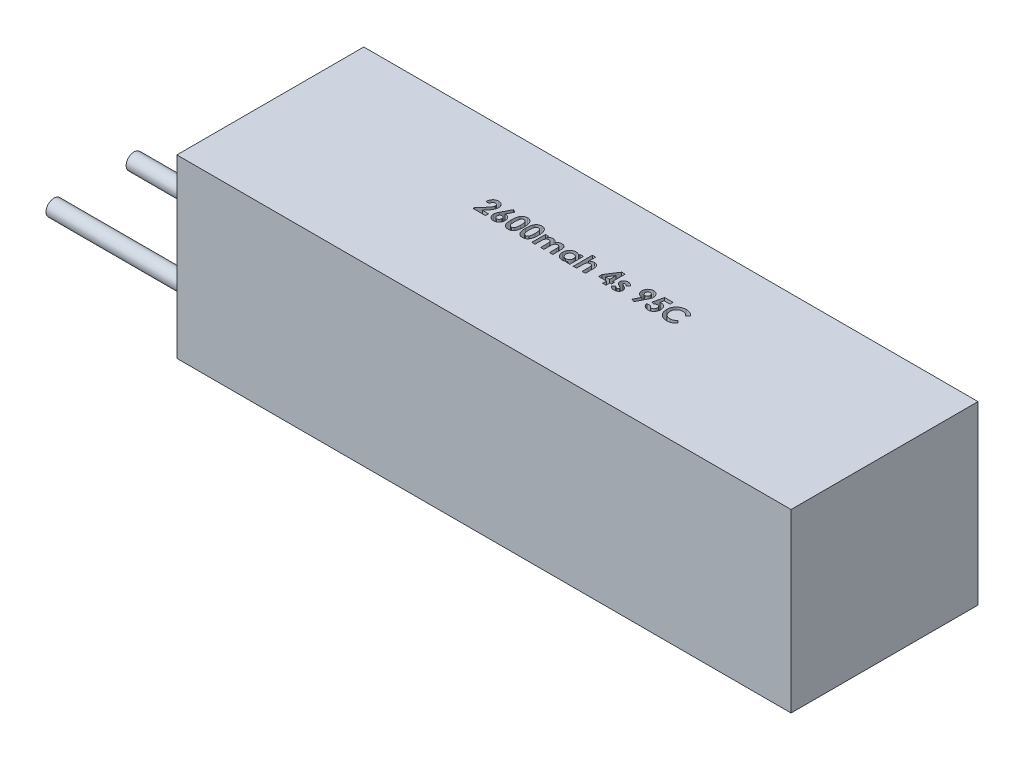
from build123d import *

# Parameters (mm, degrees)
SKETCH_1_W          = 115
SKETCH_1_H          = 35
EXTRUDE_1_DEPTH     = 33
SKETCH_2_R          = 1.5
EXTRUDE_2_DEPTH     = 33
CUT_EXTRUDE_1_DEPTH = 5


with BuildPart() as part:
    # 草图1 → 凸台-拉伸1 (new body)
    with BuildSketch(Plane(origin=(0, 0, 0), x_dir=(1, 0, 0), z_dir=(0, 1, 0))):
        Rectangle(SKETCH_1_W, SKETCH_1_H)
    extrude(amount=EXTRUDE_1_DEPTH)

    # 草图2 → 凸台-拉伸2 (add)
    with BuildSketch(Plane.ZY.offset(57.5)):
        with Locations(Location((-7.5, 3, 0), (0, 0, 180))):
            Circle(SKETCH_2_R)
        with Locations(Location((7.5, 3, 0), (0, 0, 180))):
            Circle(SKETCH_2_R)
    extrude(amount=EXTRUDE_2_DEPTH)

    # 草图3 → 切除-拉伸1 (cut)
    # profile 1 of 12: a face of its own
    with BuildSketch(Plane(origin=(0, 33, 0), x_dir=(1, 0, 0), z_dir=(0, 1, 0))):
        with BuildLine():
            Line((-20.376591675, 3.878020707), (-21.004796803, 3.878020707))
            add(Edge.make_bspline(
                [(-21.004796803, 3.878020707), (-21.002083681, 3.925541102), (-20.996782405, 4.018393099), (-20.975695266, 4.153263599), (-20.947439223, 4.28070139), (-20.909727784, 4.400260682), (-20.862340892, 4.51189803), (-20.806497936, 4.615994012), (-20.740772254, 4.71200056), (-20.666562705, 4.799454677), (-20.585129162, 4.877910573), (-20.498162268, 4.947474498), (-20.404331745, 5.004876899), (-20.305351953, 5.052113761), (-20.201239748, 5.089853818), (-20.091010064, 5.1150861), (-19.975617329, 5.132173649), (-19.896621658, 5.133668878), (-19.856359303, 5.134430963)],
                knots=[0, 0, 0, 0, 1.199038563, 2.342849363, 3.436047546, 4.486744587, 5.497670872, 6.488682221, 7.459191391, 8.424610317, 9.374430501, 10.305433194, 11.225809216, 12.140057399, 13.06607119, 14.010487599, 14.985989317, 16, 16, 16, 16], degree=3))
            add(Edge.make_bspline(
                [(-19.856359303, 5.134430963), (-19.806937833, 5.132888883), (-19.710455543, 5.129878382), (-19.570259122, 5.104197802), (-19.439330994, 5.061243064), (-19.31776633, 5.001223967), (-19.206600033, 4.924975997), (-19.105850536, 4.83406277), (-19.018564665, 4.726576881), (-18.944189003, 4.606990641), (-18.882391716, 4.480365644), (-18.839086751, 4.349430146), (-18.810622864, 4.217658644), (-18.807587015, 4.128930384), (-18.806078854, 4.084851637)],
                knots=[0, 0, 0, 0, 1.075374347, 2.099382735, 3.09057751, 4.06680945, 5.040638231, 6.016817125, 7.011024321, 8.044445721, 9.0776792, 10.070479129, 11.0414456, 12, 12, 12, 12], degree=3))
            add(Edge.make_bspline(
                [(-18.806078854, 4.084851637), (-18.806666052, 4.058189695), (-18.807847937, 4.004525791), (-18.816065738, 3.923319135), (-18.828394063, 3.84060066), (-18.846982172, 3.756441292), (-18.870163069, 3.670817439), (-18.898284847, 3.583472858), (-18.931999819, 3.49490276), (-18.97074535, 3.404110305), (-19.016968867, 3.310800725), (-19.070789728, 3.213575273), (-19.13363646, 3.112520195), (-19.204749953, 3.007064902), (-19.28447559, 2.897375714), (-19.373202564, 2.783783047), (-19.469908948, 2.665886638), (-19.53854419, 2.587079505), (-19.57380722, 2.546590419)],
                knots=[0, 0, 0, 0, 0.728284026, 1.46585585, 2.227944881, 3.01186502, 3.81876927, 4.650621989, 5.517437689, 6.406905708, 7.346299482, 8.360816762, 9.441613733, 10.596154504, 11.834900912, 13.145207542, 14.533280747, 16, 16, 16, 16], degree=3))
            Line((-19.57380722, 2.546590419), (-19.939091675, 2.128020707))
            Line((-19.939091675, 2.128020707), (-18.761207059, 2.128020707))
            Line((-18.761207059, 2.128020707), (-18.761207059, 1.544687374))
            Line((-18.761207059, 1.544687374), (-21.094540393, 1.544687374))
            Line((-21.094540393, 1.544687374), (-21.094540393, 1.862996669))
            Line((-21.094540393, 1.862996669), (-20.05828238, 2.965861252))
            add(Edge.make_bspline(
                [(-20.05828238, 2.965861252), (-20.028280047, 2.998032154), (-19.970174427, 3.060337652), (-19.887496117, 3.151839903), (-19.81267955, 3.238673356), (-19.747276108, 3.32176261), (-19.687853503, 3.39841259), (-19.637061383, 3.47093362), (-19.594435042, 3.538670085), (-19.548158103, 3.620348432), (-19.504210223, 3.717764395), (-19.463885384, 3.829991579), (-19.439304603, 3.937254921), (-19.435911678, 4.007150019), (-19.434283982, 4.040680963)],
                knots=[0, 0, 0, 0, 1.246127091, 2.413378631, 3.493388633, 4.492180848, 5.408488754, 6.240484944, 6.999099869, 7.674939598, 8.898438119, 10.020720584, 11.050475521, 12, 12, 12, 12], degree=3))
            add(Edge.make_bspline(
                [(-19.434283982, 4.040680963), (-19.435500971, 4.073119565), (-19.437859083, 4.135974556), (-19.463772816, 4.225385446), (-19.50391927, 4.30633788), (-19.560491295, 4.376412908), (-19.629017734, 4.433998204), (-19.708206472, 4.47682853), (-19.797411886, 4.501541432), (-19.859946582, 4.504634604), (-19.892116514, 4.506225835)],
                knots=[0, 0, 0, 0, 1.062038974, 2.057870785, 3.028805853, 4.01125022, 4.991535629, 5.949134679, 6.94496649, 8, 8, 8, 8], degree=3))
            add(Edge.make_bspline(
                [(-19.892116514, 4.506225835), (-19.908735911, 4.505638015), (-19.941453863, 4.504480798), (-19.989546695, 4.496777513), (-20.03531048, 4.483201277), (-20.079254594, 4.465011032), (-20.120910054, 4.440899731), (-20.160171792, 4.411178712), (-20.19745348, 4.376603253), (-20.232584129, 4.337281466), (-20.264557606, 4.293398341), (-20.292956331, 4.245354659), (-20.316437349, 4.193180243), (-20.33711089, 4.137563876), (-20.353055315, 4.077908191), (-20.364664834, 4.014570221), (-20.373490776, 3.94765301), (-20.375539238, 3.90165372), (-20.376591675, 3.878020707)],
                knots=[0, 0, 0, 0, 0.903469896, 1.778625579, 2.63899355, 3.493148037, 4.358286772, 5.247621495, 6.164656832, 7.118446693, 8.109501108, 9.111810964, 10.146451449, 11.215617525, 12.33435995, 13.498009769, 14.714554818, 16, 16, 16, 16], degree=3))
        make_face()
    # profile 2 of 12: a face of its own
    with BuildSketch(Plane(origin=(0, 33, 0), x_dir=(1, 0, 0), z_dir=(0, 1, 0))):
        with BuildLine():
            Line((-17.114973085, 5.134430963), (-16.558983502, 4.852580002))
            Line((-16.558983502, 4.852580002), (-17.168959463, 3.653661733))
            add(Edge.make_bspline(
                [(-17.168959463, 3.653661733), (-17.132922656, 3.652728722), (-17.061942254, 3.650891003), (-16.957508994, 3.636038256), (-16.857668855, 3.610361417), (-16.761415151, 3.576326836), (-16.669924493, 3.530618057), (-16.581723373, 3.476245079), (-16.499093598, 3.409931384), (-16.42014054, 3.336459328), (-16.348348929, 3.255062849), (-16.285985222, 3.167599747), (-16.231636353, 3.076198009), (-16.18938773, 2.978812758), (-16.155308583, 2.877058264), (-16.130718979, 2.77052777), (-16.116689922, 2.658912789), (-16.114755783, 2.583087676), (-16.113771162, 2.544487053)],
                knots=[0, 0, 0, 0, 1.013260694, 1.995783107, 2.958651975, 3.908806537, 4.861209129, 5.829647963, 6.817170299, 7.835534541, 8.860094905, 9.863329007, 10.853101798, 11.844815043, 12.84250023, 13.867713965, 14.914507806, 16, 16, 16, 16], degree=3))
            add(Edge.make_bspline(
                [(-16.113771162, 2.544487053), (-16.114693833, 2.507278395), (-16.116517558, 2.433732832), (-16.131593063, 2.325713106), (-16.155955871, 2.222074496), (-16.190775216, 2.123023981), (-16.235033418, 2.028077399), (-16.289158203, 1.937290466), (-16.353598428, 1.851341603), (-16.426689138, 1.770687501), (-16.506589893, 1.697170691), (-16.59080964, 1.631824671), (-16.680062048, 1.57784638), (-16.772660141, 1.532260447), (-16.870308707, 1.498243466), (-16.97154643, 1.472566538), (-17.077141025, 1.457749836), (-17.148815931, 1.455886619), (-17.185085264, 1.454943784)],
                knots=[0, 0, 0, 0, 1.049934834, 2.075270938, 3.072134561, 4.05064612, 5.033440221, 6.024524368, 7.028587226, 8.060776465, 9.092543989, 10.090062252, 11.064205434, 12.031961459, 12.998029633, 13.977230324, 14.976426867, 16, 16, 16, 16], degree=3))
            add(Edge.make_bspline(
                [(-17.185085264, 1.454943784), (-17.223011965, 1.455717519), (-17.297589691, 1.457238964), (-17.406715569, 1.474275141), (-17.511376678, 1.49992073), (-17.610984805, 1.536538273), (-17.706159384, 1.583163769), (-17.795779906, 1.640858131), (-17.880601299, 1.708985145), (-17.959719244, 1.786012059), (-18.030998616, 1.870384505), (-18.094573859, 1.957985071), (-18.148358596, 2.048951221), (-18.191896087, 2.143185696), (-18.225865047, 2.240388213), (-18.249500515, 2.340743254), (-18.264901204, 2.443984628), (-18.266706584, 2.514050066), (-18.267617316, 2.549394906)],
                knots=[0, 0, 0, 0, 1.063775006, 2.091769615, 3.092589432, 4.084662827, 5.064601646, 6.061867366, 7.070035304, 8.113879863, 9.156342271, 10.166834137, 11.149076039, 12.117706134, 13.076241869, 14.034148791, 15.008317125, 16, 16, 16, 16], degree=3))
            add(Edge.make_bspline(
                [(-18.267617316, 2.549394906), (-18.267136103, 2.576765349), (-18.266170998, 2.631658591), (-18.256472274, 2.713858238), (-18.241726807, 2.796273652), (-18.22463488, 2.865818387), (-18.20703534, 2.924625739), (-18.189321268, 2.974392812), (-18.167368579, 3.029623381), (-18.142273404, 3.090458482), (-18.11324659, 3.156824932), (-18.080439769, 3.228541832), (-18.043771266, 3.306152276), (-18.017621573, 3.359458634), (-18.003995521, 3.387235451)],
                knots=[0, 0, 0, 0, 1.110454016, 2.227089276, 3.35462975, 4.507227546, 5.131400587, 5.845402449, 6.650387134, 7.543487832, 8.516250726, 9.590168902, 10.744287919, 12, 12, 12, 12], degree=3))
            Line((-18.003995521, 3.387235451), (-17.114973085, 5.134430963))
        make_face()
        with BuildLine():
            add(Edge.make_bspline(
                [(-17.1991077, 3.070328399), (-17.229250894, 3.068945795), (-17.288237168, 3.066240219), (-17.372106828, 3.037906113), (-17.44857693, 2.993456952), (-17.514862159, 2.931552899), (-17.570303654, 2.857575125), (-17.61104401, 2.773193592), (-17.635551599, 2.679534349), (-17.63809778, 2.614049367), (-17.639412187, 2.580244265)],
                knots=[0, 0, 0, 0, 0.981744412, 1.921144944, 2.858899012, 3.85339082, 4.86292663, 5.863643845, 6.897155691, 8, 8, 8, 8], degree=3))
            add(Edge.make_bspline(
                [(-17.639412187, 2.580244265), (-17.637855888, 2.546427905), (-17.634828782, 2.480652825), (-17.609399677, 2.386101778), (-17.56776434, 2.299804039), (-17.509373436, 2.224845899), (-17.440823353, 2.162624839), (-17.364809443, 2.11660939), (-17.282599643, 2.08834059), (-17.225733117, 2.084891421), (-17.197004335, 2.083148912)],
                knots=[0, 0, 0, 0, 1.098279937, 2.136227893, 3.159405121, 4.194678092, 5.206500211, 6.154139736, 7.067477469, 8, 8, 8, 8], degree=3))
            add(Edge.make_bspline(
                [(-17.197004335, 2.083148912), (-17.166663494, 2.084922456), (-17.107159836, 2.088400684), (-17.021321906, 2.115479985), (-16.942908442, 2.160724524), (-16.873575772, 2.222746378), (-16.814020326, 2.296849145), (-16.772813973, 2.383653785), (-16.746209269, 2.478887267), (-16.743418919, 2.545701097), (-16.74197629, 2.580244265)],
                knots=[0, 0, 0, 0, 0.96921794, 1.900804717, 2.848419905, 3.844199796, 4.861108892, 5.867439427, 6.897452859, 8, 8, 8, 8], degree=3))
            add(Edge.make_bspline(
                [(-16.74197629, 2.580244265), (-16.743619707, 2.614029629), (-16.746802377, 2.679458932), (-16.770707998, 2.773556947), (-16.813389869, 2.857613242), (-16.870085773, 2.931858267), (-16.938652188, 2.993734717), (-17.018182779, 3.038256653), (-17.105883745, 3.06619002), (-17.167579978, 3.068928827), (-17.1991077, 3.070328399)],
                knots=[0, 0, 0, 0, 1.083229974, 2.097801324, 3.086792542, 4.086858909, 5.079819718, 6.026392613, 6.991456328, 8, 8, 8, 8], degree=3))
        make_face(mode=Mode.SUBTRACT)
    # profile 3 of 12: a face of its own
    with BuildSketch(Plane(origin=(0, 33, 0), x_dir=(1, 0, 0), z_dir=(0, 1, 0))):
        with BuildLine():
            add(Edge.make_bspline(
                [(-14.486467476, 5.134430963), (-14.45605974, 5.133979552), (-14.396270008, 5.133091957), (-14.308210986, 5.123478575), (-14.223385802, 5.108955437), (-14.141462608, 5.088700723), (-14.063031096, 5.061894331), (-13.987520425, 5.029807539), (-13.91582939, 4.990757329), (-13.847043702, 4.946648112), (-13.781189857, 4.896710224), (-13.719850607, 4.839778454), (-13.661905765, 4.777162804), (-13.608609626, 4.707916637), (-13.558781928, 4.632669821), (-13.512586398, 4.551410423), (-13.470376675, 4.463740735), (-13.431679687, 4.369502548), (-13.397076718, 4.267283273), (-13.36793068, 4.15591041), (-13.342933076, 4.035358527), (-13.321833334, 3.90532755), (-13.305885339, 3.765644637), (-13.29513607, 3.616402588), (-13.287759412, 3.457889118), (-13.287157381, 3.34915018), (-13.286848085, 3.29328513)],
                knots=[0, 0, 0, 0, 0.879237366, 1.728815576, 2.559023295, 3.367336655, 4.166867292, 4.954216142, 5.737608147, 6.525189134, 7.316157332, 8.124696809, 8.942788509, 9.781158001, 10.649253743, 11.551476218, 12.482711956, 13.461909668, 14.496590415, 15.601789533, 16.789733467, 18.056700938, 19.410929216, 20.8549011, 22.384193279, 24, 24, 24, 24], degree=3))
            add(Edge.make_bspline(
                [(-13.286848085, 3.29328513), (-13.28718235, 3.236721146), (-13.287831822, 3.126818339), (-13.29482942, 2.966855024), (-13.306879614, 2.816529388), (-13.322410775, 2.675856982), (-13.343684216, 2.544912093), (-13.368598373, 2.423355662), (-13.398204472, 2.311231751), (-13.433947252, 2.208792998), (-13.472410006, 2.114389309), (-13.514735191, 2.026890555), (-13.560185086, 1.946059743), (-13.607717206, 1.870677428), (-13.659937438, 1.802965845), (-13.714304074, 1.740622445), (-13.773184337, 1.686021967), (-13.834099139, 1.636350549), (-13.899280035, 1.593424475), (-13.968054833, 1.555882039), (-14.041649667, 1.525430665), (-14.118723029, 1.498945686), (-14.200588649, 1.479932328), (-14.285945696, 1.464845854), (-14.375757831, 1.456508143), (-14.436905551, 1.455473795), (-14.468238309, 1.454943784)],
                knots=[0, 0, 0, 0, 1.643780988, 3.193836972, 4.651895693, 6.025988579, 7.305620092, 8.505800249, 9.631074763, 10.672816429, 11.65661981, 12.592235626, 13.49536222, 14.350718032, 15.179365177, 15.97804903, 16.751647189, 17.51006938, 18.259804725, 19.016521909, 19.783502495, 20.571750527, 21.382245291, 22.22305063, 23.089471752, 24, 24, 24, 24], degree=3))
            add(Edge.make_bspline(
                [(-14.468238309, 1.454943784), (-14.499570222, 1.455484019), (-14.560948979, 1.456542331), (-14.651003975, 1.46478386), (-14.736813371, 1.479993444), (-14.819326681, 1.499091656), (-14.897969624, 1.525372064), (-14.973119292, 1.556734522), (-15.044197849, 1.594042712), (-15.1114021, 1.637068799), (-15.174502591, 1.686407878), (-15.234479902, 1.741532212), (-15.291201361, 1.802302074), (-15.343804094, 1.869398139), (-15.393149581, 1.941924812), (-15.438723226, 2.020710314), (-15.480497641, 2.105639935), (-15.519779538, 2.196832058), (-15.553910535, 2.296249944), (-15.584285537, 2.404781383), (-15.609167939, 2.523331074), (-15.629180032, 2.651860931), (-15.645157676, 2.790098659), (-15.657043206, 2.93811098), (-15.664079673, 3.095966836), (-15.664722333, 3.204469028), (-15.665053213, 3.260332406)],
                knots=[0, 0, 0, 0, 0.917216111, 1.796812873, 2.643793957, 3.46689424, 4.273913431, 5.068098542, 5.848489301, 6.620921603, 7.401012384, 8.190319798, 9.003608147, 9.831726257, 10.68377682, 11.569763213, 12.493818149, 13.453288342, 14.474581811, 15.568529029, 16.750744269, 18.018426408, 19.375425659, 20.823733699, 22.36466933, 24, 24, 24, 24], degree=3))
            add(Edge.make_bspline(
                [(-15.665053213, 3.260332406), (-15.664453855, 3.337950171), (-15.663297387, 3.487714649), (-15.648641766, 3.704080776), (-15.627131033, 3.90407378), (-15.595536861, 4.087359122), (-15.556471104, 4.254615638), (-15.506445368, 4.40474153), (-15.449494706, 4.539814126), (-15.400965426, 4.619831944), (-15.377593277, 4.658369265)],
                knots=[0, 0, 0, 0, 1.288568992, 2.486310467, 3.599230591, 4.627010532, 5.572937695, 6.447898582, 7.252493626, 8, 8, 8, 8], degree=3))
            add(Edge.make_bspline(
                [(-15.377593277, 4.658369265), (-15.350417255, 4.696228316), (-15.297282777, 4.770250222), (-15.204375658, 4.867427148), (-15.104559054, 4.950537613), (-14.99578279, 5.017700754), (-14.879767207, 5.070665612), (-14.755516254, 5.108074095), (-14.623488767, 5.12987002), (-14.53282329, 5.132887946), (-14.486467476, 5.134430963)],
                knots=[0, 0, 0, 0, 1.058512271, 2.069600068, 3.047294572, 4.004278952, 4.967380941, 5.939006123, 6.946246673, 8, 8, 8, 8], degree=3))
        make_face()
        with BuildLine():
            add(Edge.make_bspline(
                [(-14.471042796, 4.506225835), (-14.498531642, 4.504922919), (-14.55242437, 4.50236851), (-14.630625287, 4.480685189), (-14.704363868, 4.44719413), (-14.760454838, 4.406892876), (-14.802438371, 4.368259292), (-14.831772567, 4.333297154), (-14.860060775, 4.294281929), (-14.885046345, 4.249453058), (-14.908639245, 4.200421298), (-14.93169662, 4.146964071), (-14.950597613, 4.087768355), (-14.969167337, 4.023842259), (-14.985436149, 3.953418396), (-14.999065846, 3.87592113), (-15.011242783, 3.790846488), (-15.019736341, 3.698138746), (-15.027654886, 3.5978949), (-15.033331275, 3.489891644), (-15.03570443, 3.374158117), (-15.036458784, 3.294454155), (-15.036848085, 3.253321188)],
                knots=[0, 0, 0, 0, 1.076674018, 2.110852608, 3.161083442, 4.239746716, 4.804137807, 5.395870207, 6.026861976, 6.692161227, 7.405688833, 8.16177676, 8.973626916, 9.841385931, 10.773283133, 11.807421078, 12.927755683, 14.143907515, 15.458935494, 16.872852025, 18.386167141, 20, 20, 20, 20], degree=3))
            add(Edge.make_bspline(
                [(-15.036848085, 3.253321188), (-15.036207343, 3.200031441), (-15.034978673, 3.0978444), (-15.028543474, 2.950895877), (-15.015644651, 2.817160889), (-14.99960112, 2.695733063), (-14.977067326, 2.587399892), (-14.951140737, 2.491136444), (-14.919123704, 2.408169844), (-14.882121855, 2.337300207), (-14.841140639, 2.277011555), (-14.796653726, 2.225765929), (-14.750175736, 2.181389635), (-14.700255941, 2.145343318), (-14.647013433, 2.117719082), (-14.59089269, 2.09784931), (-14.531858048, 2.085686195), (-14.491431734, 2.083999562), (-14.471042796, 2.083148912)],
                knots=[0, 0, 0, 0, 1.771748488, 3.397459088, 4.888034009, 6.237357457, 7.467047327, 8.564189669, 9.548206622, 10.417051504, 11.216568818, 11.965764335, 12.669334354, 13.348544111, 14.005342236, 14.656555988, 15.322436492, 16, 16, 16, 16], degree=3))
            add(Edge.make_bspline(
                [(-14.471042796, 2.083148912), (-14.451353543, 2.08373099), (-14.412804433, 2.084870627), (-14.356591198, 2.096568843), (-14.303431968, 2.115587601), (-14.253487248, 2.142490969), (-14.206578393, 2.176702718), (-14.162934664, 2.218373189), (-14.122885213, 2.267917739), (-14.099552222, 2.304687123), (-14.087529175, 2.323633688)],
                knots=[0, 0, 0, 0, 0.992283464, 1.942767638, 2.88273346, 3.832339453, 4.79467288, 5.803907806, 6.868395428, 8, 8, 8, 8], degree=3))
            add(Edge.make_bspline(
                [(-14.087529175, 2.323633688), (-14.073374062, 2.349523563), (-14.043691937, 2.403812531), (-14.009343732, 2.495423141), (-13.980431327, 2.598744768), (-13.955546843, 2.714098959), (-13.938527374, 2.841940684), (-13.923870227, 2.981459288), (-13.916800722, 3.133357332), (-13.915650828, 3.238592844), (-13.915053213, 3.29328513)],
                knots=[0, 0, 0, 0, 0.710965849, 1.490837728, 2.352621235, 3.297892224, 4.334225155, 5.461620853, 6.680770821, 8, 8, 8, 8], degree=3))
            add(Edge.make_bspline(
                [(-13.915053213, 3.29328513), (-13.915284059, 3.348452172), (-13.915728397, 3.454639309), (-13.923880724, 3.607083436), (-13.935233463, 3.746315846), (-13.951839241, 3.87202569), (-13.973205594, 3.984518135), (-13.999539704, 4.083785828), (-14.03058566, 4.170024406), (-14.067402465, 4.243147879), (-14.108179364, 4.305292799), (-14.151465287, 4.358608321), (-14.197443264, 4.404127768), (-14.246036406, 4.442022438), (-14.298369418, 4.470976809), (-14.35344267, 4.491420989), (-14.411369068, 4.503789033), (-14.450883072, 4.505402604), (-14.471042796, 4.506225835)],
                knots=[0, 0, 0, 0, 1.793836731, 3.452829483, 4.963243077, 6.335886805, 7.574563692, 8.684454726, 9.672768357, 10.54971625, 11.340229787, 12.085688095, 12.778991901, 13.440269426, 14.083255152, 14.715733572, 15.344777694, 16, 16, 16, 16], degree=3))
        make_face(mode=Mode.SUBTRACT)
    # profile 4 of 12: a face of its own
    with BuildSketch(Plane(origin=(0, 33, 0), x_dir=(1, 0, 0), z_dir=(0, 1, 0))):
        with BuildLine():
            add(Edge.make_bspline(
                [(-11.794159784, 5.134430963), (-11.763752048, 5.133979552), (-11.703962316, 5.133091957), (-11.615903294, 5.123478575), (-11.53107811, 5.108955437), (-11.449154916, 5.088700723), (-11.370723403, 5.061894331), (-11.295212732, 5.029807539), (-11.223521698, 4.990757329), (-11.15473601, 4.946648112), (-11.088882165, 4.896710224), (-11.027542914, 4.839778454), (-10.969598073, 4.777162804), (-10.916301933, 4.707916637), (-10.866474236, 4.632669821), (-10.820278706, 4.551410423), (-10.778068982, 4.463740735), (-10.739371994, 4.369502548), (-10.704769026, 4.267283273), (-10.675622988, 4.15591041), (-10.650625383, 4.035358527), (-10.629525641, 3.90532755), (-10.613577647, 3.765644637), (-10.602828377, 3.616402588), (-10.59545172, 3.457889118), (-10.594849689, 3.34915018), (-10.594540393, 3.29328513)],
                knots=[0, 0, 0, 0, 0.879237366, 1.728815576, 2.559023295, 3.367336655, 4.166867292, 4.954216142, 5.737608147, 6.525189134, 7.316157332, 8.124696809, 8.942788509, 9.781158001, 10.649253743, 11.551476218, 12.482711956, 13.461909668, 14.496590415, 15.601789533, 16.789733467, 18.056700938, 19.410929216, 20.8549011, 22.384193279, 24, 24, 24, 24], degree=3))
            add(Edge.make_bspline(
                [(-10.594540393, 3.29328513), (-10.594874658, 3.236721146), (-10.595524129, 3.126818339), (-10.602521728, 2.966855024), (-10.614571922, 2.816529388), (-10.630103082, 2.675856982), (-10.651376524, 2.544912093), (-10.676290681, 2.423355662), (-10.70589678, 2.311231751), (-10.74163956, 2.208792998), (-10.780102314, 2.114389309), (-10.822427499, 2.026890555), (-10.867877394, 1.946059743), (-10.915409514, 1.870677428), (-10.967629745, 1.802965845), (-11.021996382, 1.740622445), (-11.080876645, 1.686021967), (-11.141791446, 1.636350549), (-11.206972343, 1.593424475), (-11.27574714, 1.555882039), (-11.349341974, 1.525430665), (-11.426415336, 1.498945686), (-11.508280957, 1.479932328), (-11.593638003, 1.464845854), (-11.683450139, 1.456508143), (-11.744597858, 1.455473795), (-11.775930617, 1.454943784)],
                knots=[0, 0, 0, 0, 1.643780988, 3.193836972, 4.651895693, 6.025988579, 7.305620092, 8.505800249, 9.631074763, 10.672816429, 11.65661981, 12.592235626, 13.49536222, 14.350718032, 15.179365177, 15.97804903, 16.751647189, 17.51006938, 18.259804725, 19.016521909, 19.783502495, 20.571750527, 21.382245291, 22.22305063, 23.089471752, 24, 24, 24, 24], degree=3))
            add(Edge.make_bspline(
                [(-11.775930617, 1.454943784), (-11.80726253, 1.455484019), (-11.868641287, 1.456542331), (-11.958696283, 1.46478386), (-12.044505679, 1.479993444), (-12.127018988, 1.499091656), (-12.205661932, 1.525372064), (-12.2808116, 1.556734522), (-12.351890157, 1.594042712), (-12.419094408, 1.637068799), (-12.482194899, 1.686407878), (-12.54217221, 1.741532212), (-12.598893669, 1.802302074), (-12.651496402, 1.869398139), (-12.700841888, 1.941924812), (-12.746415534, 2.020710314), (-12.788189949, 2.105639935), (-12.827471846, 2.196832058), (-12.861602842, 2.296249944), (-12.891977844, 2.404781383), (-12.916860247, 2.523331074), (-12.93687234, 2.651860931), (-12.952849984, 2.790098659), (-12.964735514, 2.93811098), (-12.971771981, 3.095966836), (-12.972414641, 3.204469028), (-12.972745521, 3.260332406)],
                knots=[0, 0, 0, 0, 0.917216111, 1.796812873, 2.643793957, 3.46689424, 4.273913431, 5.068098542, 5.848489301, 6.620921603, 7.401012384, 8.190319798, 9.003608147, 9.831726257, 10.68377682, 11.569763213, 12.493818149, 13.453288342, 14.474581811, 15.568529029, 16.750744269, 18.018426408, 19.375425659, 20.823733699, 22.36466933, 24, 24, 24, 24], degree=3))
            add(Edge.make_bspline(
                [(-12.972745521, 3.260332406), (-12.972146163, 3.337950171), (-12.970989694, 3.487714649), (-12.956334074, 3.704080776), (-12.93482334, 3.90407378), (-12.903229168, 4.087359122), (-12.864163411, 4.254615638), (-12.814137675, 4.40474153), (-12.757187014, 4.539814126), (-12.708657734, 4.619831944), (-12.685285585, 4.658369265)],
                knots=[0, 0, 0, 0, 1.288568992, 2.486310467, 3.599230591, 4.627010532, 5.572937695, 6.447898582, 7.252493626, 8, 8, 8, 8], degree=3))
            add(Edge.make_bspline(
                [(-12.685285585, 4.658369265), (-12.658109563, 4.696228316), (-12.604975085, 4.770250222), (-12.512067965, 4.867427148), (-12.412251361, 4.950537613), (-12.303475097, 5.017700754), (-12.187459515, 5.070665612), (-12.063208561, 5.108074095), (-11.931181075, 5.12987002), (-11.840515597, 5.132887946), (-11.794159784, 5.134430963)],
                knots=[0, 0, 0, 0, 1.058512271, 2.069600068, 3.047294572, 4.004278952, 4.967380941, 5.939006123, 6.946246673, 8, 8, 8, 8], degree=3))
        make_face()
        with BuildLine():
            add(Edge.make_bspline(
                [(-11.778735104, 4.506225835), (-11.806223949, 4.504922919), (-11.860116678, 4.50236851), (-11.938317594, 4.480685189), (-12.012056176, 4.44719413), (-12.068147146, 4.406892876), (-12.110130679, 4.368259292), (-12.139464874, 4.333297154), (-12.167753082, 4.294281929), (-12.192738652, 4.249453058), (-12.216331553, 4.200421298), (-12.239388928, 4.146964071), (-12.258289921, 4.087768355), (-12.276859645, 4.023842259), (-12.293128456, 3.953418396), (-12.306758154, 3.87592113), (-12.31893509, 3.790846488), (-12.327428649, 3.698138746), (-12.335347194, 3.5978949), (-12.341023582, 3.489891644), (-12.343396738, 3.374158117), (-12.344151092, 3.294454155), (-12.344540393, 3.253321188)],
                knots=[0, 0, 0, 0, 1.076674018, 2.110852608, 3.161083442, 4.239746716, 4.804137807, 5.395870207, 6.026861976, 6.692161227, 7.405688833, 8.16177676, 8.973626916, 9.841385931, 10.773283133, 11.807421078, 12.927755683, 14.143907515, 15.458935494, 16.872852025, 18.386167141, 20, 20, 20, 20], degree=3))
            add(Edge.make_bspline(
                [(-12.344540393, 3.253321188), (-12.343899651, 3.200031441), (-12.342670981, 3.0978444), (-12.336235782, 2.950895877), (-12.323336959, 2.817160889), (-12.307293428, 2.695733063), (-12.284759634, 2.587399892), (-12.258833044, 2.491136444), (-12.226816012, 2.408169844), (-12.189814162, 2.337300207), (-12.148832946, 2.277011555), (-12.104346033, 2.225765929), (-12.057868044, 2.181389635), (-12.007948248, 2.145343318), (-11.954705741, 2.117719082), (-11.898584998, 2.09784931), (-11.839550356, 2.085686195), (-11.799124041, 2.083999562), (-11.778735104, 2.083148912)],
                knots=[0, 0, 0, 0, 1.771748488, 3.397459088, 4.888034009, 6.237357457, 7.467047327, 8.564189669, 9.548206622, 10.417051504, 11.216568818, 11.965764335, 12.669334354, 13.348544111, 14.005342236, 14.656555988, 15.322436492, 16, 16, 16, 16], degree=3))
            add(Edge.make_bspline(
                [(-11.778735104, 2.083148912), (-11.759045851, 2.08373099), (-11.720496741, 2.084870627), (-11.664283505, 2.096568843), (-11.611124276, 2.115587601), (-11.561179556, 2.142490969), (-11.5142707, 2.176702718), (-11.470626972, 2.218373189), (-11.430577521, 2.267917739), (-11.407244529, 2.304687123), (-11.395221482, 2.323633688)],
                knots=[0, 0, 0, 0, 0.992283464, 1.942767638, 2.88273346, 3.832339453, 4.79467288, 5.803907806, 6.868395428, 8, 8, 8, 8], degree=3))
            add(Edge.make_bspline(
                [(-11.395221482, 2.323633688), (-11.381066369, 2.349523563), (-11.351384245, 2.403812531), (-11.317036039, 2.495423141), (-11.288123635, 2.598744768), (-11.26323915, 2.714098959), (-11.246219681, 2.841940684), (-11.231562535, 2.981459288), (-11.224493029, 3.133357332), (-11.223343136, 3.238592844), (-11.222745521, 3.29328513)],
                knots=[0, 0, 0, 0, 0.710965849, 1.490837728, 2.352621235, 3.297892224, 4.334225155, 5.461620853, 6.680770821, 8, 8, 8, 8], degree=3))
            add(Edge.make_bspline(
                [(-11.222745521, 3.29328513), (-11.222976367, 3.348452172), (-11.223420705, 3.454639309), (-11.231573032, 3.607083436), (-11.24292577, 3.746315846), (-11.259531549, 3.87202569), (-11.280897901, 3.984518135), (-11.307232011, 4.083785828), (-11.338277968, 4.170024406), (-11.375094773, 4.243147879), (-11.415871672, 4.305292799), (-11.459157595, 4.358608321), (-11.505135572, 4.404127768), (-11.553728714, 4.442022438), (-11.606061726, 4.470976809), (-11.661134978, 4.491420989), (-11.719061376, 4.503789033), (-11.75857538, 4.505402604), (-11.778735104, 4.506225835)],
                knots=[0, 0, 0, 0, 1.793836731, 3.452829483, 4.963243077, 6.335886805, 7.574563692, 8.684454726, 9.672768357, 10.54971625, 11.340229787, 12.085688095, 12.778991901, 13.440269426, 14.083255152, 14.715733572, 15.344777694, 16, 16, 16, 16], degree=3))
        make_face(mode=Mode.SUBTRACT)
    # profile 5 of 12: a face of its own
    with BuildSketch(Plane(origin=(0, 33, 0), x_dir=(1, 0, 0), z_dir=(0, 1, 0))):
        with BuildLine():
            Line((-10.100950649, 4.102379681), (-9.472745521, 4.102379681))
            Line((-9.472745521, 4.102379681), (-9.472745521, 3.796690579))
            add(Edge.make_bspline(
                [(-9.472745521, 3.796690579), (-9.444803276, 3.824892334), (-9.389787292, 3.880419271), (-9.298615045, 3.951804141), (-9.20351316, 4.012847025), (-9.103329151, 4.06226508), (-8.998308066, 4.099999335), (-8.88894765, 4.12765044), (-8.774686181, 4.143963726), (-8.696889565, 4.146143411), (-8.657340873, 4.147251476)],
                knots=[0, 0, 0, 0, 1.041528618, 2.050684245, 3.032913108, 4.004406485, 4.976926473, 5.95771665, 6.961784757, 8, 8, 8, 8], degree=3))
            add(Edge.make_bspline(
                [(-8.657340873, 4.147251476), (-8.617739964, 4.146005851), (-8.539786855, 4.143553879), (-8.426053811, 4.121116033), (-8.318309924, 4.084662116), (-8.217740628, 4.032701537), (-8.123619069, 3.968532922), (-8.040114893, 3.888841119), (-7.9649511, 3.796798485), (-7.924885905, 3.727213264), (-7.904336066, 3.69152231)],
                knots=[0, 0, 0, 0, 1.023965777, 2.015643508, 2.987309376, 3.958410333, 4.93654923, 5.924956801, 6.93568961, 8, 8, 8, 8], degree=3))
            add(Edge.make_bspline(
                [(-7.904336066, 3.69152231), (-7.877865218, 3.727310358), (-7.825910371, 3.797552253), (-7.733815673, 3.889261011), (-7.634233829, 3.968541231), (-7.525238158, 4.033175274), (-7.409723207, 4.084484757), (-7.288194456, 4.120980587), (-7.161753725, 4.143516379), (-7.075703869, 4.145996101), (-7.032140553, 4.147251476)],
                knots=[0, 0, 0, 0, 1.041189987, 2.043563759, 3.033412161, 4.015238574, 5.00275396, 5.986226558, 6.980513695, 8, 8, 8, 8], degree=3))
            add(Edge.make_bspline(
                [(-7.032140553, 4.147251476), (-6.98714482, 4.145947962), (-6.899519813, 4.14340949), (-6.772538596, 4.118435365), (-6.65360532, 4.079846595), (-6.545348377, 4.02369049), (-6.447459008, 3.95717136), (-6.364045457, 3.878576232), (-6.294819832, 3.790647626), (-6.249745072, 3.708543763), (-6.220605451, 3.635954545), (-6.203010689, 3.572788325), (-6.186554143, 3.502255251), (-6.174731761, 3.423407259), (-6.16369609, 3.33698546), (-6.157289448, 3.242415293), (-6.152934788, 3.140015341), (-6.152472268, 3.069165373), (-6.1522327, 3.032467822)],
                knots=[0, 0, 0, 0, 1.321991808, 2.574456155, 3.791773975, 4.987670122, 6.148905103, 7.262530793, 8.344737981, 9.427709016, 10.004683293, 10.642050061, 11.354108788, 12.133887687, 12.985666279, 13.916212488, 14.92067847, 16, 16, 16, 16], degree=3))
            Line((-6.1522327, 3.032467822), (-6.1522327, 1.544687374))
            Line((-6.1522327, 1.544687374), (-6.780437828, 1.544687374))
            Line((-6.780437828, 1.544687374), (-6.780437828, 2.829142502))
            add(Edge.make_bspline(
                [(-6.780437828, 2.829142502), (-6.78096069, 2.863499289), (-6.781964276, 2.929444037), (-6.786230907, 3.024029189), (-6.795781451, 3.109809758), (-6.806975913, 3.187260891), (-6.822995403, 3.255971932), (-6.842528263, 3.316108517), (-6.865186262, 3.367757211), (-6.892545112, 3.410912632), (-6.923187057, 3.447256312), (-6.9572718, 3.478410044), (-6.994443956, 3.504990342), (-7.035040546, 3.527646269), (-7.080125094, 3.54296892), (-7.12817562, 3.55499162), (-7.179568131, 3.563179164), (-7.215100902, 3.563667281), (-7.233362508, 3.563918143)],
                knots=[0, 0, 0, 0, 1.669139205, 3.203761885, 4.596586177, 5.860166715, 7.002923539, 8.018877315, 8.928339525, 9.734594377, 10.491888885, 11.231098709, 11.971440889, 12.708030942, 13.480072485, 14.275788656, 15.113863979, 16, 16, 16, 16], degree=3))
            add(Edge.make_bspline(
                [(-7.233362508, 3.563918143), (-7.261503384, 3.56294524), (-7.316724254, 3.561036111), (-7.397192316, 3.54279225), (-7.472913355, 3.512965489), (-7.543603689, 3.472388822), (-7.60774222, 3.421709332), (-7.663847198, 3.361598625), (-7.710182085, 3.291710277), (-7.742256224, 3.22686791), (-7.762298532, 3.16823738), (-7.776436558, 3.118025039), (-7.787456588, 3.06124231), (-7.796082045, 2.998464268), (-7.804357163, 2.929336024), (-7.80841689, 2.853944993), (-7.812571229, 2.772395911), (-7.812517149, 2.716035004), (-7.812489111, 2.686814778)],
                knots=[0, 0, 0, 0, 1.129913425, 2.217230253, 3.297175357, 4.391411011, 5.481605898, 6.571841268, 7.681894157, 8.841607612, 9.468549532, 10.170608623, 10.93710061, 11.791434153, 12.717934886, 13.734733707, 14.825576123, 16, 16, 16, 16], degree=3))
            Line((-7.812489111, 2.686814778), (-7.812489111, 1.544687374))
            Line((-7.812489111, 1.544687374), (-8.440694239, 1.544687374))
            Line((-8.440694239, 1.544687374), (-8.440694239, 2.770949393))
            add(Edge.make_bspline(
                [(-8.440694239, 2.770949393), (-8.440746983, 2.798296651), (-8.440848446, 2.850903916), (-8.443898219, 2.926869814), (-8.447936713, 2.997013903), (-8.453598213, 3.061531827), (-8.460127638, 3.120343343), (-8.469551103, 3.173126709), (-8.479451322, 3.220172779), (-8.496425381, 3.273615711), (-8.520344014, 3.332839423), (-8.556078801, 3.395642872), (-8.599287039, 3.44822596), (-8.648876642, 3.490997895), (-8.704915022, 3.523586677), (-8.765982551, 3.547828681), (-8.833245277, 3.56091377), (-8.87954444, 3.562895552), (-8.903434623, 3.563918143)],
                knots=[0, 0, 0, 0, 1.256487322, 2.417074606, 3.49288742, 4.484586665, 5.393016842, 6.210437544, 6.947749329, 7.599905853, 8.784490193, 9.876739139, 10.906602197, 11.896672079, 12.869113195, 13.872201355, 14.902064413, 16, 16, 16, 16], degree=3))
            add(Edge.make_bspline(
                [(-8.903434623, 3.563918143), (-8.930428474, 3.563001925), (-8.983890022, 3.561187347), (-9.061764934, 3.5416973), (-9.136220571, 3.512417805), (-9.205618986, 3.470709394), (-9.268791266, 3.418837261), (-9.324334514, 3.357016755), (-9.370425894, 3.285321206), (-9.402642403, 3.218690253), (-9.42239247, 3.158596973), (-9.436910648, 3.107080822), (-9.447520663, 3.049047608), (-9.456373081, 2.985148943), (-9.464599208, 2.9153094), (-9.468675732, 2.839221852), (-9.472825967, 2.756970637), (-9.472772982, 2.700142777), (-9.472745521, 2.670688976)],
                knots=[0, 0, 0, 0, 1.07893236, 2.136834559, 3.195274846, 4.273923004, 5.364443877, 6.458052972, 7.587287137, 8.767908, 9.410170275, 10.118584836, 10.909717261, 11.770069756, 12.702352573, 13.724628867, 14.820678298, 16, 16, 16, 16], degree=3))
            Line((-9.472745521, 2.670688976), (-9.472745521, 1.544687374))
            Line((-9.472745521, 1.544687374), (-10.100950649, 1.544687374))
            Line((-10.100950649, 1.544687374), (-10.100950649, 4.102379681))
        make_face()
    # profile 6 of 12: a face of its own
    with BuildSketch(Plane(origin=(0, 33, 0), x_dir=(1, 0, 0), z_dir=(0, 1, 0))):
        with BuildLine():
            Line((-3.594540393, 4.102379681), (-2.966335264, 4.102379681))
            Line((-2.966335264, 4.102379681), (-2.966335264, 1.544687374))
            Line((-2.966335264, 1.544687374), (-3.594540393, 1.544687374))
            Line((-3.594540393, 1.544687374), (-3.594540393, 1.823733848))
            add(Edge.make_bspline(
                [(-3.594540393, 1.823733848), (-3.625667725, 1.796571762), (-3.686079731, 1.743855517), (-3.781269504, 1.67545485), (-3.876737432, 1.619033139), (-3.972942241, 1.574096323), (-4.07136256, 1.54091511), (-4.172706975, 1.516891136), (-4.278434953, 1.502723612), (-4.350307376, 1.50079502), (-4.386808021, 1.499815579)],
                knots=[0, 0, 0, 0, 1.129196829, 2.191548051, 3.199897424, 4.157751732, 5.089409408, 6.034969131, 7.002052659, 8, 8, 8, 8], degree=3))
            add(Edge.make_bspline(
                [(-4.386808021, 1.499815579), (-4.427781617, 1.500737357), (-4.508747765, 1.502558842), (-4.627556599, 1.521732911), (-4.742278339, 1.551083098), (-4.852819864, 1.592617281), (-4.958980054, 1.64643744), (-5.061571356, 1.711139331), (-5.158835041, 1.788994379), (-5.251580798, 1.876633992), (-5.336498257, 1.973038191), (-5.410733901, 2.076868897), (-5.473309032, 2.186653502), (-5.524573488, 2.302028019), (-5.564899603, 2.42290777), (-5.593646353, 2.549676148), (-5.610606968, 2.682378428), (-5.612706214, 2.772770025), (-5.613771162, 2.818625675)],
                knots=[0, 0, 0, 0, 0.980476535, 1.937477201, 2.874147792, 3.812856188, 4.758993464, 5.720109578, 6.712210464, 7.737600662, 8.772720504, 9.783789959, 10.789002326, 11.793715968, 12.802552247, 13.835794126, 14.902098527, 16, 16, 16, 16], degree=3))
            add(Edge.make_bspline(
                [(-5.613771162, 2.818625675), (-5.612653495, 2.866109261), (-5.610461068, 2.959253605), (-5.594423595, 3.095938502), (-5.566207331, 3.225850092), (-5.527732427, 3.34916832), (-5.478241144, 3.465914492), (-5.417964068, 3.576279876), (-5.346081186, 3.679975993), (-5.263248907, 3.775237864), (-5.17381039, 3.862549969), (-5.078126989, 3.938562081), (-4.977694982, 4.003137907), (-4.872407643, 4.055856841), (-4.762280007, 4.096595365), (-4.647746857, 4.126378552), (-4.528299745, 4.144249511), (-4.446931405, 4.146242511), (-4.405738309, 4.147251476)],
                knots=[0, 0, 0, 0, 1.136281865, 2.228943489, 3.287578264, 4.313574083, 5.316051562, 6.317280042, 7.318008486, 8.329309503, 9.333984563, 10.305318864, 11.248632312, 12.186624717, 13.117503092, 14.05354244, 15.014596925, 16, 16, 16, 16], degree=3))
            add(Edge.make_bspline(
                [(-4.405738309, 4.147251476), (-4.367580155, 4.146458733), (-4.292078922, 4.144890179), (-4.181102988, 4.127858685), (-4.073472338, 4.10209976), (-3.969774103, 4.065397929), (-3.869157715, 4.019054401), (-3.77335384, 3.960982505), (-3.68026668, 3.893622978), (-3.623468877, 3.841013761), (-3.594540393, 3.814218624)],
                knots=[0, 0, 0, 0, 1.017011718, 2.012299608, 2.98747302, 3.965332399, 4.941441765, 5.936729654, 6.94912688, 8, 8, 8, 8], degree=3))
            Line((-3.594540393, 3.814218624), (-3.594540393, 4.102379681))
        make_face()
        with BuildLine():
            add(Edge.make_bspline(
                [(-4.273927412, 3.563918143), (-4.298959534, 3.563150071), (-4.34802086, 3.5616447), (-4.420172254, 3.55258979), (-4.489127341, 3.536634634), (-4.554394341, 3.513064317), (-4.61694597, 3.484352238), (-4.675832374, 3.44839083), (-4.731539558, 3.405885211), (-4.783739904, 3.357864441), (-4.83132821, 3.305080834), (-4.872352107, 3.247482482), (-4.907215792, 3.186621335), (-4.936701409, 3.122314402), (-4.95780642, 3.053800735), (-4.974521581, 2.98197226), (-4.983195667, 2.906242174), (-4.984768006, 2.854634464), (-4.985566034, 2.82844138)],
                knots=[0, 0, 0, 0, 1.04836806, 2.054732945, 3.03993516, 4.00574415, 4.955904794, 5.917688631, 6.888591924, 7.88601754, 8.884115178, 9.859153345, 10.841239365, 11.818093293, 12.814750328, 13.83810466, 14.90274714, 16, 16, 16, 16], degree=3))
            add(Edge.make_bspline(
                [(-4.985566034, 2.82844138), (-4.984780196, 2.802010709), (-4.983231712, 2.749929379), (-4.97438133, 2.673560483), (-4.958267649, 2.600682762), (-4.934758398, 2.531885384), (-4.906048148, 2.466240043), (-4.871101318, 2.4040497), (-4.828175258, 2.346413958), (-4.780545236, 2.291968961), (-4.727274008, 2.243351692), (-4.67125161, 2.20018402), (-4.61171282, 2.164065657), (-4.549303591, 2.134874567), (-4.484233996, 2.111086283), (-4.415688259, 2.095331651), (-4.344337872, 2.085260013), (-4.295696429, 2.083857472), (-4.271122925, 2.083148912)],
                knots=[0, 0, 0, 0, 1.099136573, 2.165835871, 3.191374663, 4.196217796, 5.183857741, 6.167377911, 7.154730987, 8.166690795, 9.170734848, 10.148332609, 11.103258353, 12.059567475, 13.009337315, 13.978056681, 14.978520572, 16, 16, 16, 16], degree=3))
            add(Edge.make_bspline(
                [(-4.271122925, 2.083148912), (-4.24562455, 2.08392129), (-4.195633873, 2.085435571), (-4.122305366, 2.094407845), (-4.052423964, 2.110421502), (-3.986280412, 2.134126764), (-3.922864429, 2.162632748), (-3.862748287, 2.197891442), (-3.806584338, 2.240299522), (-3.754088137, 2.288754402), (-3.705985489, 2.341969019), (-3.664394264, 2.400322681), (-3.628166785, 2.461949079), (-3.599675539, 2.528305284), (-3.577049495, 2.598230374), (-3.56081583, 2.672158317), (-3.551985658, 2.750168818), (-3.550450716, 2.803414025), (-3.549668598, 2.830544746)],
                knots=[0, 0, 0, 0, 1.050008698, 2.058587853, 3.036635738, 3.995319155, 4.947022481, 5.895997462, 6.858296291, 7.838991643, 8.833936038, 9.806048392, 10.784806122, 11.771666913, 12.772873988, 13.80724452, 14.882696879, 16, 16, 16, 16], degree=3))
            add(Edge.make_bspline(
                [(-3.549668598, 2.830544746), (-3.550440998, 2.85720883), (-3.551949719, 2.909291534), (-3.560853912, 2.985673212), (-3.577202827, 3.058149549), (-3.59936319, 3.126853764), (-3.628361303, 3.191628767), (-3.664616193, 3.251756356), (-3.705751187, 3.309319729), (-3.754386401, 3.361096724), (-3.806598218, 3.409200753), (-3.863588149, 3.450326382), (-3.923560701, 3.485769591), (-3.986884347, 3.514869832), (-4.054145435, 3.536201412), (-4.12414626, 3.552717674), (-4.197978978, 3.561639266), (-4.248198137, 3.563146121), (-4.273927412, 3.563918143)],
                knots=[0, 0, 0, 0, 1.106611376, 2.161533483, 3.185006901, 4.184773755, 5.152708835, 6.122342771, 7.094156588, 8.082475533, 9.064254463, 10.03606828, 10.992420271, 11.951521816, 12.920622147, 13.915721683, 14.932141191, 16, 16, 16, 16], degree=3))
        make_face(mode=Mode.SUBTRACT)
    # profile 7 of 12: a face of its own
    with BuildSketch(Plane(origin=(0, 33, 0), x_dir=(1, 0, 0), z_dir=(0, 1, 0))):
        with BuildLine():
            Line((-2.338130136, 5.134430963), (-1.709925008, 5.134430963))
            Line((-1.709925008, 5.134430963), (-1.709925008, 3.825436572))
            add(Edge.make_bspline(
                [(-1.709925008, 3.825436572), (-1.678280984, 3.851171362), (-1.616601299, 3.901332926), (-1.519823849, 3.966681541), (-1.423246573, 4.022446389), (-1.325844641, 4.067639986), (-1.228040619, 4.103055562), (-1.129665616, 4.128171696), (-1.030624927, 4.144650098), (-0.96422953, 4.146383425), (-0.930978694, 4.147251476)],
                knots=[0, 0, 0, 0, 1.13710654, 2.216417683, 3.252896077, 4.244436563, 5.207303112, 6.149540546, 7.073289332, 8, 8, 8, 8], degree=3))
            add(Edge.make_bspline(
                [(-0.930978694, 4.147251476), (-0.899159876, 4.14640719), (-0.836696864, 4.144749786), (-0.745059839, 4.132778118), (-0.657289868, 4.112177964), (-0.573170736, 4.083859481), (-0.493281165, 4.045775294), (-0.41658228, 4.001164477), (-0.343985751, 3.947716545), (-0.299814898, 3.906516273), (-0.277533181, 3.885733047)],
                knots=[0, 0, 0, 0, 1.056403236, 2.073808271, 3.062028718, 4.046096703, 5.014652014, 5.995532726, 6.988858718, 8, 8, 8, 8], degree=3))
            add(Edge.make_bspline(
                [(-0.277533181, 3.885733047), (-0.259234009, 3.866313025), (-0.222370163, 3.827191218), (-0.176457227, 3.759746125), (-0.136811864, 3.686281682), (-0.104506546, 3.606107551), (-0.080480584, 3.519186409), (-0.061879618, 3.426234327), (-0.051592888, 3.326236373), (-0.050323363, 3.257316541), (-0.049668598, 3.221770707)],
                knots=[0, 0, 0, 0, 0.887296576, 1.787466942, 2.706642908, 3.663267187, 4.658426068, 5.705361056, 6.816525637, 8, 8, 8, 8], degree=3))
            Line((-0.049668598, 3.221770707), (-0.049668598, 1.544687374))
            Line((-0.049668598, 1.544687374), (-0.677873726, 1.544687374))
            Line((-0.677873726, 1.544687374), (-0.677873726, 2.65666654))
            add(Edge.make_bspline(
                [(-0.677873726, 2.65666654), (-0.677995788, 2.691957402), (-0.678229426, 2.759507752), (-0.680327504, 2.856511828), (-0.683753732, 2.944636323), (-0.688439255, 3.023907868), (-0.694981268, 3.093995174), (-0.701415798, 3.1554006), (-0.710444952, 3.207829808), (-0.723964965, 3.264799125), (-0.74596759, 3.325732408), (-0.777940985, 3.390684668), (-0.820648657, 3.444290245), (-0.870072225, 3.488501407), (-0.927217422, 3.522245038), (-0.990038507, 3.547167499), (-1.05960944, 3.561183274), (-1.10783288, 3.562982709), (-1.132901771, 3.563918143)],
                knots=[0, 0, 0, 0, 1.461461505, 2.797388094, 4.017818807, 5.113567707, 6.085313608, 6.932873269, 7.669572396, 8.286941306, 9.355291607, 10.346554054, 11.270113241, 12.175128673, 13.078071705, 14.003657132, 14.962203834, 16, 16, 16, 16], degree=3))
            add(Edge.make_bspline(
                [(-1.132901771, 3.563918143), (-1.165559108, 3.56264146), (-1.229522186, 3.560140933), (-1.321248068, 3.534400994), (-1.405853128, 3.493715753), (-1.482349944, 3.437327841), (-1.549008802, 3.366699734), (-1.604858638, 3.28391654), (-1.650540746, 3.18980627), (-1.670285375, 3.121179433), (-1.680477893, 3.085753079)],
                knots=[0, 0, 0, 0, 0.993549393, 1.945978497, 2.879753144, 3.843180486, 4.826017097, 5.826060929, 6.877775219, 8, 8, 8, 8], degree=3))
            add(Edge.make_bspline(
                [(-1.680477893, 3.085753079), (-1.683015851, 3.074803308), (-1.688803227, 3.049834247), (-1.69323531, 3.007232741), (-1.699812449, 2.955734821), (-1.702093953, 2.895031882), (-1.706367752, 2.825217553), (-1.707904777, 2.74617888), (-1.709452172, 2.657841554), (-1.709762329, 2.595903866), (-1.709925008, 2.563417342)],
                knots=[0, 0, 0, 0, 0.514379255, 1.17295301, 1.959069106, 2.891908278, 3.953016936, 5.163065833, 6.51201855, 8, 8, 8, 8], degree=3))
            Line((-1.709925008, 2.563417342), (-1.709925008, 1.544687374))
            Line((-1.709925008, 1.544687374), (-2.338130136, 1.544687374))
            Line((-2.338130136, 1.544687374), (-2.338130136, 5.134430963))
        make_face()
    # profile 8 of 12: a face of its own
    with BuildSketch(Plane(origin=(0, 33, 0), x_dir=(1, 0, 0), z_dir=(0, 1, 0))):
        Polygon((3.154458005, 5.134430963), (3.809305761, 5.134430963), (3.809305761, 2.845969425), (4.123408325, 2.845969425), (4.123408325, 2.262636092), (3.809305761, 2.262636092), (3.809305761, 1.544687374), (3.181100633, 1.544687374), (3.181100633, 2.262636092), (1.700331402, 2.262636092), (1.700331402, 2.89855356), align=None)
        Polygon((3.181100633, 2.845969425), (3.181100633, 4.037175354), (2.40636105, 2.845969425), align=None, mode=Mode.SUBTRACT)
    # profile 9 of 12: a face of its own
    with BuildSketch(Plane(origin=(0, 33, 0), x_dir=(1, 0, 0), z_dir=(0, 1, 0))):
        with BuildLine():
            Line((6.187510889, 3.707648111), (5.803296146, 3.294687374))
            add(Edge.make_bspline(
                [(5.803296146, 3.294687374), (5.784110463, 3.315917372), (5.74741552, 3.356522316), (5.691239108, 3.411875931), (5.635899272, 3.45796914), (5.582427266, 3.496689357), (5.529731001, 3.526383135), (5.478248501, 3.547747143), (5.427955064, 3.561309333), (5.394618448, 3.563064907), (5.378416338, 3.563918143)],
                knots=[0, 0, 0, 0, 1.327646587, 2.539285, 3.655602211, 4.666613517, 5.598770349, 6.454635452, 7.248928967, 8, 8, 8, 8], degree=3))
            add(Edge.make_bspline(
                [(5.378416338, 3.563918143), (5.36202143, 3.563418482), (5.330630282, 3.562461788), (5.286330337, 3.554255747), (5.247409872, 3.540049578), (5.214476265, 3.520685246), (5.188016823, 3.496830377), (5.169491333, 3.46954097), (5.157051296, 3.43966579), (5.15599895, 3.418444295), (5.155459607, 3.407567983)],
                knots=[0, 0, 0, 0, 1.295068245, 2.479652818, 3.543291146, 4.55379989, 5.481948265, 6.332409746, 7.145336708, 8, 8, 8, 8], degree=3))
            add(Edge.make_bspline(
                [(5.155459607, 3.407567983), (5.157286949, 3.391085669), (5.161078469, 3.356886781), (5.187120958, 3.317221174), (5.221577052, 3.287960668), (5.261294964, 3.260732087), (5.315083301, 3.230287618), (5.355888498, 3.2094414), (5.378416338, 3.197932566)],
                knots=[0, 0, 0, 0, 0.916701701, 1.902049539, 2.5493345, 3.440293453, 4.586830489, 6, 6, 6, 6], degree=3))
            Line((5.378416338, 3.197932566), (5.6055798, 3.082948592))
            add(Edge.make_bspline(
                [(5.6055798, 3.082948592), (5.634479335, 3.068274346), (5.690549863, 3.039803553), (5.769379773, 2.993862106), (5.842188334, 2.949332356), (5.907515029, 2.903695377), (5.965759698, 2.857744036), (6.016508632, 2.811023935), (6.06099275, 2.765016189), (6.110598785, 2.70333238), (6.160219708, 2.621174565), (6.201588147, 2.514332154), (6.227968297, 2.399927425), (6.230886957, 2.32074355), (6.232382684, 2.280164137)],
                knots=[0, 0, 0, 0, 1.076693506, 2.088987655, 3.030641824, 3.911722491, 4.735175175, 5.493635918, 6.202154166, 6.859459289, 8.120623445, 9.372284821, 10.653373066, 12, 12, 12, 12], degree=3))
            add(Edge.make_bspline(
                [(6.232382684, 2.280164137), (6.231481499, 2.252787539), (6.22971764, 2.199204272), (6.218566895, 2.120334812), (6.198537271, 2.045341633), (6.172178315, 1.973055741), (6.136673591, 1.904784285), (6.093569117, 1.840196309), (6.043545528, 1.778443808), (5.985280379, 1.721639214), (5.921451882, 1.668697954), (5.850495736, 1.624170553), (5.775549314, 1.585020733), (5.694632649, 1.55444821), (5.608881104, 1.529662016), (5.517559609, 1.512485805), (5.420978038, 1.501676375), (5.354841897, 1.500446377), (5.320924351, 1.499815579)],
                knots=[0, 0, 0, 0, 0.976600749, 1.911466839, 2.833459288, 3.740827163, 4.650527853, 5.570709661, 6.506801416, 7.479409329, 8.468875524, 9.458587492, 10.461481786, 11.480119772, 12.538142914, 13.641687514, 14.790552763, 16, 16, 16, 16], degree=3))
            add(Edge.make_bspline(
                [(5.320924351, 1.499815579), (5.275986515, 1.501246599), (5.1877775, 1.504055566), (5.058954618, 1.52362243), (4.937311619, 1.557492999), (4.822748422, 1.604941335), (4.714563344, 1.665403522), (4.61430139, 1.740423861), (4.520224427, 1.828047756), (4.465489472, 1.895251202), (4.437510889, 1.929603239)],
                knots=[0, 0, 0, 0, 1.056901255, 2.07460411, 3.05625841, 4.019970729, 4.984811261, 5.963335951, 6.958928997, 8, 8, 8, 8], degree=3))
            Line((4.437510889, 1.929603239), (4.818220024, 2.352379681))
            add(Edge.make_bspline(
                [(4.818220024, 2.352379681), (4.836769459, 2.332814798), (4.873596153, 2.293972105), (4.935671079, 2.242752764), (5.001350746, 2.196070102), (5.071366327, 2.156871898), (5.141396056, 2.125221112), (5.208583802, 2.101478595), (5.27166334, 2.086558026), (5.312676029, 2.084246198), (5.3321423, 2.083148912)],
                knots=[0, 0, 0, 0, 1.087861918, 2.159761696, 3.243809206, 4.338405912, 5.394481878, 6.343674753, 7.213841449, 8, 8, 8, 8], degree=3))
            add(Edge.make_bspline(
                [(5.3321423, 2.083148912), (5.351598034, 2.083712363), (5.388997325, 2.084795472), (5.442151401, 2.096061926), (5.489264308, 2.1150025), (5.529217807, 2.141264086), (5.562450058, 2.171408376), (5.585865808, 2.205667538), (5.601349542, 2.24199529), (5.603231409, 2.267394271), (5.604177556, 2.280164137)],
                knots=[0, 0, 0, 0, 1.255011871, 2.412479185, 3.488767498, 4.514443302, 5.48617286, 6.365347346, 7.178144445, 8, 8, 8, 8], degree=3))
            add(Edge.make_bspline(
                [(5.604177556, 2.280164137), (5.603333312, 2.292189653), (5.601599916, 2.316880356), (5.587876565, 2.353325601), (5.566330634, 2.389412241), (5.536447603, 2.425242022), (5.49782984, 2.460524226), (5.45061555, 2.494976255), (5.395893966, 2.530436167), (5.355473489, 2.551600986), (5.334245665, 2.56271622)],
                knots=[0, 0, 0, 0, 0.704666567, 1.446816302, 2.258757648, 3.165368109, 4.175243826, 5.322435858, 6.59381024, 8, 8, 8, 8], degree=3))
            Line((5.334245665, 2.56271622), (5.126012492, 2.667884489))
            add(Edge.make_bspline(
                [(5.126012492, 2.667884489), (5.078776896, 2.693214105), (4.988102261, 2.741837472), (4.865544051, 2.825216212), (4.76181622, 2.913974541), (4.676834237, 3.007635617), (4.609120425, 3.105936607), (4.561885498, 3.210129072), (4.532170414, 3.319225246), (4.52890128, 3.393826393), (4.527254479, 3.431406124)],
                knots=[0, 0, 0, 0, 1.255999728, 2.41104856, 3.467751088, 4.449286722, 5.368722015, 6.253902015, 7.120417131, 8, 8, 8, 8], degree=3))
            add(Edge.make_bspline(
                [(4.527254479, 3.431406124), (4.527825576, 3.455761773), (4.528946731, 3.503575869), (4.540882105, 3.573794183), (4.558913894, 3.641291833), (4.584358691, 3.706176012), (4.616953031, 3.768511103), (4.656886753, 3.828020466), (4.704647044, 3.884595914), (4.758704895, 3.938055205), (4.818683778, 3.986742883), (4.882870005, 4.02989155), (4.951073723, 4.066646192), (5.023854673, 4.095949607), (5.100287769, 4.119273301), (5.18087755, 4.135127084), (5.265280184, 4.145210146), (5.322998125, 4.146561392), (5.352474832, 4.147251476)],
                knots=[0, 0, 0, 0, 0.959035663, 1.882742823, 2.798841253, 3.708806893, 4.623422363, 5.566085165, 6.527241613, 7.536786942, 8.55815439, 9.567237405, 10.580975912, 11.605536372, 12.654523293, 13.725718749, 14.838518481, 16, 16, 16, 16], degree=3))
            add(Edge.make_bspline(
                [(5.352474832, 4.147251476), (5.393226569, 4.145909761), (5.47411158, 4.143246693), (5.593401062, 4.121697129), (5.708622329, 4.085477286), (5.819452361, 4.035572399), (5.924465537, 3.972856139), (6.021352567, 3.896697418), (6.11076915, 3.808971609), (6.161676289, 3.741757998), (6.187510889, 3.707648111)],
                knots=[0, 0, 0, 0, 0.996590028, 1.978055413, 2.954661574, 3.945146934, 4.945404762, 5.939399542, 6.954276554, 8, 8, 8, 8], degree=3))
        make_face()
    # profile 10 of 12: a face of its own
    with BuildSketch(Plane(origin=(0, 33, 0), x_dir=(1, 0, 0), z_dir=(0, 1, 0))):
        with BuildLine():
            Line((9.073328197, 1.454943784), (8.516637492, 1.735392502))
            Line((8.516637492, 1.735392502), (9.126613454, 2.935713015))
            add(Edge.make_bspline(
                [(9.126613454, 2.935713015), (9.090574674, 2.936631595), (9.019821829, 2.938434991), (8.915643785, 2.953421195), (8.816020829, 2.979003602), (8.719778736, 3.01306023), (8.628248503, 3.058716669), (8.540320252, 3.113205233), (8.457211208, 3.17867246), (8.378531708, 3.252260329), (8.306694809, 3.333598745), (8.244341901, 3.421076834), (8.18999417, 3.512475534), (8.147730393, 3.609858237), (8.113783912, 3.711409971), (8.088980901, 3.817656379), (8.075062108, 3.929063602), (8.073116655, 4.004886139), (8.072126274, 4.043485451)],
                knots=[0, 0, 0, 0, 1.014336294, 1.991387562, 2.955278539, 3.906441712, 4.859855302, 5.829322156, 6.813833455, 7.833278715, 8.858926674, 9.863225732, 10.85404919, 11.846815163, 12.845559416, 13.865450493, 14.913355531, 16, 16, 16, 16], degree=3))
            add(Edge.make_bspline(
                [(8.072126274, 4.043485451), (8.073044906, 4.080926402), (8.074855051, 4.154703023), (8.08988848, 4.262983093), (8.114629614, 4.366947779), (8.148573563, 4.46657942), (8.193761598, 4.561206182), (8.246653042, 4.6523097), (8.311310432, 4.738005142), (8.384351287, 4.818663482), (8.464290626, 4.892451622), (8.549099555, 4.957329429), (8.638392459, 5.011561041), (8.731021837, 5.057105591), (8.828662031, 5.091133646), (8.929902032, 5.116807561), (9.03549601, 5.131625079), (9.107171, 5.133488184), (9.143440377, 5.134430963)],
                knots=[0, 0, 0, 0, 1.055538678, 2.079917126, 3.075849687, 4.065898488, 5.041806164, 6.028602842, 7.031727914, 8.062953097, 9.093756959, 10.095582084, 11.068815425, 12.035667573, 13.000833448, 13.979119574, 14.977382875, 16, 16, 16, 16], degree=3))
            add(Edge.make_bspline(
                [(9.143440377, 5.134430963), (9.181364397, 5.133650339), (9.255936851, 5.132115345), (9.36510091, 5.115177299), (9.469544664, 5.089191238), (9.569692483, 5.053896866), (9.664301075, 5.005995097), (9.754162076, 4.948584494), (9.83897658, 4.880394809), (9.917833741, 4.80339148), (9.989553448, 4.719635953), (10.053124044, 4.631964121), (10.106526044, 4.540547408), (10.150265548, 4.446201677), (10.184338402, 4.348779123), (10.207759147, 4.248141557), (10.223307923, 4.144461074), (10.225077064, 4.074158044), (10.225972428, 4.038577598)],
                knots=[0, 0, 0, 0, 1.062826075, 2.08990367, 3.089830715, 4.078784409, 5.060762809, 6.057138927, 7.064407536, 8.107320944, 9.143871033, 10.153461498, 11.140480137, 12.108246174, 13.065926856, 14.029354859, 15.002654194, 16, 16, 16, 16], degree=3))
            add(Edge.make_bspline(
                [(10.225972428, 4.038577598), (10.225483819, 4.011441237), (10.224499652, 3.956782505), (10.214822571, 3.874815811), (10.200140489, 3.792621938), (10.183098825, 3.723517277), (10.165233011, 3.665266245), (10.147847539, 3.615851048), (10.125541468, 3.5609909), (10.100634509, 3.500318088), (10.071789319, 3.434098668), (10.038407847, 3.362649195), (10.002507576, 3.284910002), (9.976045533, 3.231753002), (9.962350633, 3.204242662)],
                knots=[0, 0, 0, 0, 1.105131805, 2.225983929, 3.357782449, 4.505488967, 5.122909461, 5.839607681, 6.638776516, 7.535249922, 8.51168636, 9.581005249, 10.748097757, 12, 12, 12, 12], degree=3))
            Line((9.962350633, 3.204242662), (9.073328197, 1.454943784))
        make_face()
        with BuildLine():
            add(Edge.make_bspline(
                [(9.157462813, 3.519046348), (9.187563785, 3.52081848), (9.24637427, 3.524280823), (9.33085162, 3.551052402), (9.406454553, 3.596865844), (9.473464178, 3.657729612), (9.52883888, 3.731986193), (9.569099913, 3.81652071), (9.593899469, 3.909582547), (9.596453257, 3.974384586), (9.5977673, 4.007728239)],
                knots=[0, 0, 0, 0, 0.984774978, 1.924027336, 2.867853169, 3.859505234, 4.871392407, 5.881338128, 6.909850265, 8, 8, 8, 8], degree=3))
            add(Edge.make_bspline(
                [(9.5977673, 4.007728239), (9.596184679, 4.041765517), (9.593106103, 4.107976149), (9.568068977, 4.203271826), (9.525285564, 4.289413466), (9.467081179, 4.364294273), (9.399128317, 4.426959943), (9.323139866, 4.472735527), (9.240960982, 4.501041681), (9.184090319, 4.504485852), (9.155359447, 4.506225835)],
                knots=[0, 0, 0, 0, 1.104110315, 2.147758178, 3.172670271, 4.206310416, 5.210906102, 6.157051016, 7.068948237, 8, 8, 8, 8], degree=3))
            add(Edge.make_bspline(
                [(9.155359447, 4.506225835), (9.124992528, 4.504529576), (9.065367332, 4.501198984), (8.979840738, 4.472960805), (8.900998644, 4.428064265), (8.832147634, 4.365185973), (8.772559726, 4.291291322), (8.731007451, 4.204858916), (8.704720041, 4.11022825), (8.701820585, 4.043898881), (8.700331402, 4.009831604)],
                knots=[0, 0, 0, 0, 0.970967322, 1.90648639, 2.855811969, 3.858352357, 4.877096915, 5.878517833, 6.91039038, 8, 8, 8, 8], degree=3))
            add(Edge.make_bspline(
                [(8.700331402, 4.009831604), (8.701886946, 3.976249932), (8.704912316, 3.910937087), (8.730267995, 3.81734746), (8.771569856, 3.73236558), (8.828032445, 3.65752338), (8.897580451, 3.596359729), (8.976546857, 3.551034293), (9.064632056, 3.524208232), (9.125962208, 3.520797949), (9.157462813, 3.519046348)],
                knots=[0, 0, 0, 0, 1.075706617, 2.092137047, 3.084482865, 4.090466434, 5.0784141, 6.035155512, 6.990809768, 8, 8, 8, 8], degree=3))
        make_face(mode=Mode.SUBTRACT)
    # profile 11 of 12: a face of its own
    with BuildSketch(Plane(origin=(0, 33, 0), x_dir=(1, 0, 0), z_dir=(0, 1, 0))):
        with BuildLine():
            Line((11.279758486, 5.044687374), (12.873408325, 5.044687374))
            Line((12.873408325, 5.044687374), (12.873408325, 4.46135404))
            Line((12.873408325, 4.46135404), (11.77755496, 4.46135404))
            Line((11.77755496, 4.46135404), (11.64083621, 3.799495066))
            add(Edge.make_bspline(
                [(11.64083621, 3.799495066), (11.659466097, 3.804683725), (11.696208061, 3.814916826), (11.751559876, 3.825179331), (11.805203499, 3.831831161), (11.840404116, 3.832718426), (11.857482845, 3.833148912)],
                knots=[0, 0, 0, 0, 1.05461699, 2.079921384, 3.068411212, 4, 4, 4, 4], degree=3))
            add(Edge.make_bspline(
                [(11.857482845, 3.833148912), (11.894699182, 3.832296121), (11.968060783, 3.830615083), (12.075379495, 3.814656544), (12.178143501, 3.789522328), (12.276038333, 3.753675751), (12.36896836, 3.707020505), (12.457046232, 3.650580736), (12.540380049, 3.584257316), (12.617489452, 3.508008719), (12.688340793, 3.424286033), (12.749941993, 3.333731089), (12.802553261, 3.237635113), (12.844398446, 3.135400775), (12.877426232, 3.027670174), (12.901292849, 2.914374273), (12.915406371, 2.795378801), (12.917309493, 2.714196698), (12.91828012, 2.672792342)],
                knots=[0, 0, 0, 0, 1.01440847, 1.999622559, 2.951875003, 3.895578053, 4.836219714, 5.782137149, 6.743708247, 7.735272588, 8.734977101, 9.730283169, 10.717124674, 11.717316708, 12.737475749, 13.78628267, 14.87096371, 16, 16, 16, 16], degree=3))
            add(Edge.make_bspline(
                [(12.91828012, 2.672792342), (12.917093998, 2.63091795), (12.914753433, 2.548287536), (12.899483392, 2.426791598), (12.872531494, 2.310425918), (12.835510365, 2.198878986), (12.786737398, 2.092970648), (12.728081229, 1.991603771), (12.658550142, 1.895530769), (12.578826475, 1.805736507), (12.492156391, 1.723662827), (12.39987321, 1.651462454), (12.30262525, 1.590706425), (12.200410165, 1.541605282), (12.093814394, 1.502757332), (11.982805585, 1.474477879), (11.86684425, 1.458261184), (11.78812157, 1.456061735), (11.748107845, 1.454943784)],
                knots=[0, 0, 0, 0, 1.06808661, 2.107647099, 3.116961351, 4.110378221, 5.100014249, 6.085620622, 7.093190682, 8.119403071, 9.144090782, 10.133780668, 11.103064255, 12.062861538, 13.020824475, 13.992378307, 14.979551724, 16, 16, 16, 16], degree=3))
            add(Edge.make_bspline(
                [(11.748107845, 1.454943784), (11.712324761, 1.455858338), (11.641753032, 1.457662029), (11.537803973, 1.468748466), (11.437585537, 1.488349392), (11.341629774, 1.516717006), (11.24892707, 1.551631063), (11.160549093, 1.59529769), (11.076010192, 1.646885414), (10.995550425, 1.705452759), (10.92047715, 1.771426602), (10.851958219, 1.84364634), (10.78957881, 1.921201679), (10.734673745, 2.005049415), (10.687415134, 2.095065669), (10.645505235, 2.190189578), (10.611201562, 2.291414539), (10.593793436, 2.361589307), (10.584946787, 2.397251476)],
                knots=[0, 0, 0, 0, 1.054957082, 2.080596141, 3.077793124, 4.061112343, 5.027190972, 5.994718051, 6.962465889, 7.943658696, 8.924948258, 9.904494768, 10.875059, 11.855380583, 12.854004648, 13.869083016, 14.917087635, 16, 16, 16, 16], degree=3))
            Line((10.584946787, 2.397251476), (11.302895505, 2.397251476))
            add(Edge.make_bspline(
                [(11.302895505, 2.397251476), (11.316019625, 2.372539045), (11.341524854, 2.324513255), (11.390041439, 2.260751802), (11.444352675, 2.206378774), (11.503968647, 2.160862936), (11.569275627, 2.126763244), (11.637612481, 2.100903615), (11.709837695, 2.085960294), (11.759026254, 2.08409223), (11.783865056, 2.083148912)],
                knots=[0, 0, 0, 0, 1.104910296, 2.147267069, 3.153527244, 4.136738762, 5.099945312, 6.05603338, 7.018353, 8, 8, 8, 8], degree=3))
            add(Edge.make_bspline(
                [(11.783865056, 2.083148912), (11.801177368, 2.083800282), (11.835239633, 2.085081862), (11.885424994, 2.091861742), (11.933329126, 2.104702682), (11.979308185, 2.122484399), (12.023485682, 2.144660209), (12.065228317, 2.172655723), (12.105262338, 2.204879599), (12.142978263, 2.241856605), (12.17713802, 2.283077365), (12.20709239, 2.327371883), (12.233875728, 2.373755923), (12.253714556, 2.424066875), (12.269960879, 2.476802434), (12.281925328, 2.532360403), (12.289075435, 2.590805668), (12.289737344, 2.630704612), (12.290074992, 2.651057566)],
                knots=[0, 0, 0, 0, 0.978869489, 1.925942215, 2.855067702, 3.774946051, 4.70828698, 5.642468714, 6.60995405, 7.609372294, 8.622401667, 9.629904756, 10.629323, 11.642352373, 12.678539694, 13.745912462, 14.850161547, 16, 16, 16, 16], degree=3))
            add(Edge.make_bspline(
                [(12.290074992, 2.651057566), (12.289683112, 2.670938082), (12.288920309, 2.709635988), (12.282610251, 2.766458377), (12.271321677, 2.82037254), (12.255940899, 2.871791419), (12.236251666, 2.920402776), (12.212190108, 2.966495967), (12.18365343, 3.009838009), (12.150488426, 3.049546501), (12.115121606, 3.085968258), (12.077126278, 3.117822437), (12.036844759, 3.144259193), (11.995528746, 3.167339251), (11.951529055, 3.184136414), (11.905835061, 3.195704001), (11.858494817, 3.20419183), (11.826205064, 3.204690521), (11.809806563, 3.204943784)],
                knots=[0, 0, 0, 0, 1.166249705, 2.270133367, 3.348514167, 4.393962215, 5.415026464, 6.420877785, 7.440098956, 8.453121383, 9.451844239, 10.415694839, 11.355045125, 12.27538808, 13.187007209, 14.108269027, 15.039275622, 16, 16, 16, 16], degree=3))
            add(Edge.make_bspline(
                [(11.809806563, 3.204943784), (11.791993979, 3.204267895), (11.75629374, 3.20291327), (11.70325212, 3.191891042), (11.650850034, 3.174052942), (11.598796074, 3.149442457), (11.547606964, 3.117235098), (11.495931799, 3.079459558), (11.445500258, 3.033371085), (11.413434481, 2.999044287), (11.396845825, 2.981285931)],
                knots=[0, 0, 0, 0, 0.88288272, 1.769486374, 2.674910571, 3.623812639, 4.617874466, 5.670434592, 6.794841017, 8, 8, 8, 8], degree=3))
            Line((11.396845825, 2.981285931), (10.868199992, 3.102580002))
            Line((10.868199992, 3.102580002), (11.279758486, 5.044687374))
        make_face()
    # profile 12 of 12: a face of its own
    with BuildSketch(Plane(origin=(0, 33, 0), x_dir=(1, 0, 0), z_dir=(0, 1, 0))):
        with BuildLine():
            Line((16.732382684, 4.437515899), (16.271745665, 3.997211412))
            add(Edge.make_bspline(
                [(16.271745665, 3.997211412), (16.23267068, 4.037615012), (16.156344994, 4.1165359), (16.033355589, 4.221020201), (15.905451085, 4.308093728), (15.775119611, 4.381426499), (15.64001688, 4.436907966), (15.501705048, 4.477338246), (15.359300952, 4.501987059), (15.262927338, 4.50480732), (15.214453998, 4.506225835)],
                knots=[0, 0, 0, 0, 1.115251505, 2.178435587, 3.19620269, 4.182487026, 5.141301733, 6.088180966, 7.038406374, 8, 8, 8, 8], degree=3))
            add(Edge.make_bspline(
                [(15.214453998, 4.506225835), (15.173972869, 4.505105159), (15.094087821, 4.502893627), (14.976795636, 4.486680917), (14.864599599, 4.459110497), (14.757115646, 4.421113353), (14.654660052, 4.371947064), (14.557018007, 4.311649685), (14.464430244, 4.240765787), (14.378119792, 4.159662126), (14.299166023, 4.071050281), (14.229405342, 3.976501655), (14.170969581, 3.876232851), (14.123012302, 3.77125932), (14.085655436, 3.661095192), (14.05897794, 3.545814633), (14.04354839, 3.425280354), (14.041245426, 3.343342049), (14.040074992, 3.301698592)],
                knots=[0, 0, 0, 0, 1.035432265, 2.043311493, 3.022114605, 3.98653278, 4.95457646, 5.923598177, 6.917315552, 7.932509744, 8.948865224, 9.949768934, 10.933144597, 11.912367597, 12.897413939, 13.903909035, 14.934704909, 16, 16, 16, 16], degree=3))
            add(Edge.make_bspline(
                [(14.040074992, 3.301698592), (14.040412298, 3.2724703), (14.041077134, 3.214860736), (14.048354946, 3.129640202), (14.060073938, 3.046956137), (14.077034223, 2.966933786), (14.098243227, 2.889503799), (14.123126217, 2.813998193), (14.154341563, 2.741460286), (14.188991067, 2.671047595), (14.229288042, 2.604681421), (14.272735614, 2.541395765), (14.319847412, 2.481500849), (14.370928583, 2.425241524), (14.42669803, 2.373496998), (14.485714319, 2.324711251), (14.548972973, 2.280105556), (14.615159951, 2.238560483), (14.684847023, 2.202469925), (14.756143417, 2.169778852), (14.830130132, 2.143228841), (14.905906334, 2.121827109), (14.983201226, 2.103628133), (15.062770823, 2.092422464), (15.143925357, 2.083936541), (15.1987722, 2.083412585), (15.226373069, 2.083148912)],
                knots=[0, 0, 0, 0, 1.103660481, 2.175337485, 3.227646561, 4.255952547, 5.262355991, 6.258840057, 7.255597736, 8.242457506, 9.22035537, 10.185017736, 11.140346927, 12.096287581, 13.051739095, 14.01125915, 14.986044842, 15.97314143, 16.960198552, 17.947847494, 18.933482797, 19.925264591, 20.920966487, 21.929612487, 22.958107872, 24, 24, 24, 24], degree=3))
            add(Edge.make_bspline(
                [(15.226373069, 2.083148912), (15.273188886, 2.084503074), (15.365169792, 2.08716365), (15.500164998, 2.107968977), (15.62880198, 2.142192563), (15.731582313, 2.182608629), (15.81210799, 2.222520018), (15.873410997, 2.259436089), (15.936803084, 2.300730766), (16.001231363, 2.347962557), (16.067420524, 2.400564661), (16.134202176, 2.459689162), (16.20328594, 2.523389175), (16.24854203, 2.568853126), (16.271745665, 2.592163335)],
                knots=[0, 0, 0, 0, 1.404581149, 2.759636711, 4.088442092, 5.392261763, 6.066678138, 6.783632037, 7.538459478, 8.336747902, 9.180226004, 10.074962426, 11.012997595, 12, 12, 12, 12], degree=3))
            Line((16.271745665, 2.592163335), (16.718360248, 2.123112854))
            add(Edge.make_bspline(
                [(16.718360248, 2.123112854), (16.686965647, 2.092802353), (16.625690099, 2.033642735), (16.533257637, 1.949641598), (16.440941504, 1.874157239), (16.350971867, 1.804449906), (16.261874928, 1.742550342), (16.173660137, 1.688396729), (16.087326123, 1.640619442), (16.001080134, 1.600024223), (15.914385501, 1.565554665), (15.825186912, 1.535878638), (15.733211678, 1.510773788), (15.637898056, 1.49051747), (15.540135075, 1.474274638), (15.439007801, 1.46331082), (15.335157433, 1.45594021), (15.264714119, 1.4552779), (15.229177556, 1.454943784)],
                knots=[0, 0, 0, 0, 1.244526981, 2.429050516, 3.560637417, 4.644440555, 5.67424972, 6.652764056, 7.595344123, 8.486817594, 9.369275933, 10.254498637, 11.166417451, 12.086725134, 13.032340136, 13.991389299, 14.986715468, 16, 16, 16, 16], degree=3))
            add(Edge.make_bspline(
                [(15.229177556, 1.454943784), (15.163901292, 1.456607806), (15.036173788, 1.459863835), (14.848992462, 1.483988804), (14.671175226, 1.524433889), (14.502289485, 1.581634395), (14.342388941, 1.654705361), (14.1915145, 1.744286935), (14.04990934, 1.850141111), (13.918717351, 1.971027177), (13.800047953, 2.104535688), (13.695157948, 2.247887202), (13.608392932, 2.40178624), (13.53635007, 2.56395922), (13.480013499, 2.735146201), (13.440362103, 2.915532356), (13.415909377, 3.10494351), (13.413234214, 3.234315695), (13.411869864, 3.300296348)],
                knots=[0, 0, 0, 0, 1.078019885, 2.10938526, 3.111377082, 4.085535484, 5.04941344, 6.010039228, 6.978205633, 7.964457913, 8.951525778, 9.924444315, 10.892603023, 11.863865945, 12.85144698, 13.863884204, 14.910567087, 16, 16, 16, 16], degree=3))
            add(Edge.make_bspline(
                [(13.411869864, 3.300296348), (13.412446372, 3.343328367), (13.413588871, 3.428607312), (13.425596638, 3.554230106), (13.442336164, 3.676689861), (13.4688919, 3.794715036), (13.50090222, 3.909895651), (13.540711259, 4.020979825), (13.588255436, 4.128286825), (13.642002291, 4.231996291), (13.70280557, 4.331428814), (13.770729507, 4.425730111), (13.844025476, 4.515628172), (13.924454659, 4.599930332), (14.010848315, 4.679376781), (14.103596501, 4.753536982), (14.202141383, 4.823474477), (14.306749687, 4.887385747), (14.41538915, 4.945196888), (14.526689544, 4.996188783), (14.640377416, 5.038806265), (14.755972084, 5.074155894), (14.873961934, 5.100541893), (14.993504784, 5.120515243), (15.1156178, 5.131680473), (15.197606112, 5.133508292), (15.238993261, 5.134430963)],
                knots=[0, 0, 0, 0, 1.071919942, 2.124283339, 3.142214191, 4.149696895, 5.136002878, 6.119640489, 7.086990633, 8.058538607, 9.028339693, 9.988281803, 10.952401235, 11.916291999, 12.888973767, 13.874849856, 14.873389453, 15.898127285, 16.927174885, 17.938320013, 18.946391617, 19.950418109, 20.947802303, 21.956882652, 22.968648068, 24, 24, 24, 24], degree=3))
            add(Edge.make_bspline(
                [(15.238993261, 5.134430963), (15.274300743, 5.133902065), (15.344548608, 5.132849768), (15.449159467, 5.124077728), (15.552933698, 5.110301327), (15.655499756, 5.089515672), (15.757591299, 5.064840473), (15.85786673, 5.032531703), (15.957907947, 4.99651749), (16.056145954, 4.953469853), (16.152717876, 4.906479468), (16.245361363, 4.85316717), (16.335631891, 4.796813739), (16.421529119, 4.73408393), (16.504662088, 4.667253071), (16.584596087, 4.596009358), (16.66062965, 4.51916495), (16.708344093, 4.46486984), (16.732382684, 4.437515899)],
                knots=[0, 0, 0, 0, 0.996412454, 1.982464992, 2.961075852, 3.949442424, 4.934965278, 5.923860011, 6.921385422, 7.934793307, 8.949617135, 9.951082467, 10.950285876, 11.951772932, 12.951063433, 13.960125323, 14.972308753, 16, 16, 16, 16], degree=3))
        make_face()
    extrude(amount=-CUT_EXTRUDE_1_DEPTH, mode=Mode.SUBTRACT)


solid = part.part
